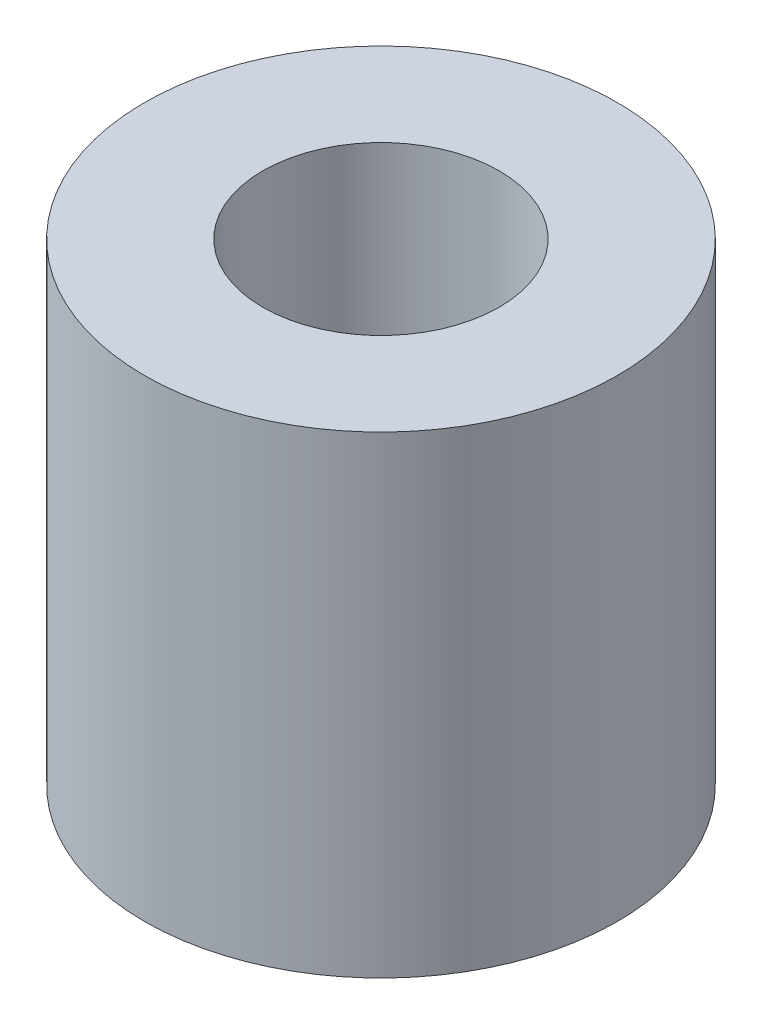
from build123d import *

# Parameters (mm, degrees)
SKETCH1_R           = 3
SKETCH1_R_2         = 1.5
BOSS_EXTRUDE1_DEPTH = 6


with BuildPart() as part:
    # Sketch1 → Boss-Extrude1 (new body)
    with BuildSketch(Plane(origin=(0, 0, 0), x_dir=(1, 0, 0), z_dir=(0, 1, 0))):
        with Locations(Location((0, 0, 0), (0, 0, 270))):
            Circle(SKETCH1_R)
        with Locations(Location((0, 0, 0), (0, 0, 270))):
            Circle(SKETCH1_R_2, mode=Mode.SUBTRACT)
    extrude(amount=BOSS_EXTRUDE1_DEPTH)


solid = part.part
